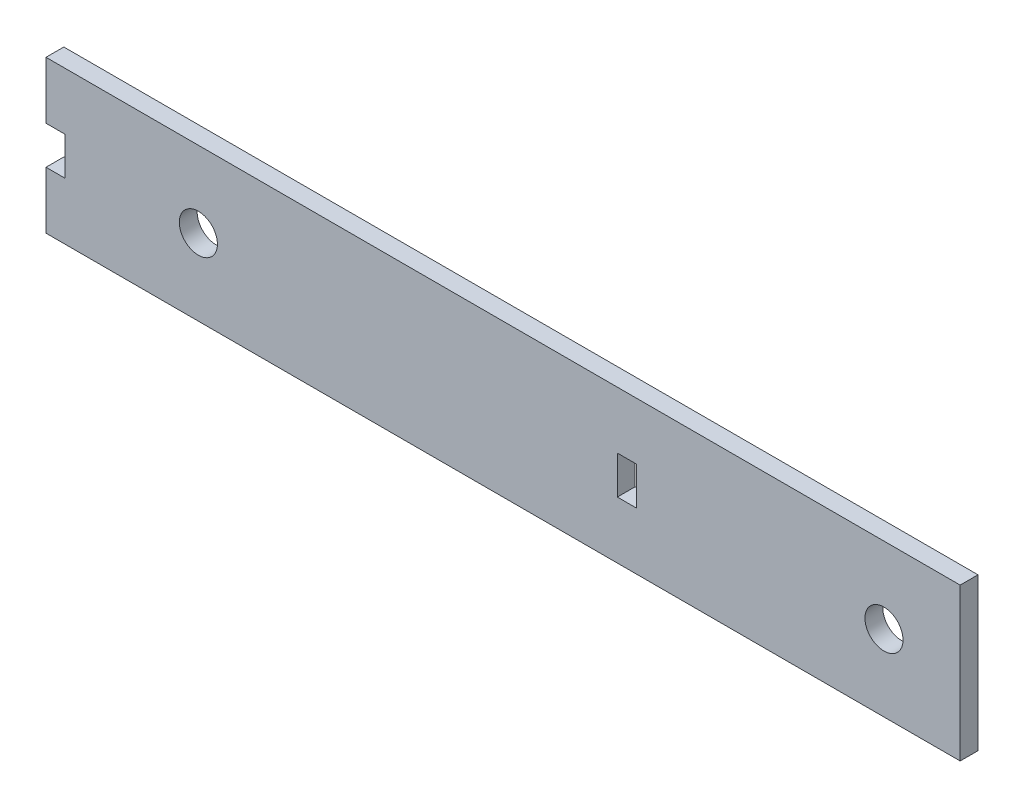
from build123d import *

# Parameters (mm, degrees)
SKETCH1_W           = 25.4
SKETCH1_H           = 152.4
BOSS_EXTRUDE1_DEPTH = 2.9718
SKETCH7_R           = 3.175
SKETCH7_W           = 6.35
SKETCH7_H           = 6.35
SKETCH7_W_2         = 3.175
CUT_EXTRUDE5_DEPTH  = 78.308224629


with BuildPart() as part:
    # Sketch1 → Boss-Extrude1 (new body)
    with BuildSketch(Plane(origin=(0, 0, 0), x_dir=(0, 1, 0), z_dir=(0, 0, 1))):
        Rectangle(SKETCH1_W, SKETCH1_H)
    extrude(amount=BOSS_EXTRUDE1_DEPTH)

    # Sketch7 → Cut-Extrude5 (cut, through all)
    with BuildSketch(Plane.XY.offset(2.9718)):
        with Locations((-50.8, 0)):
            Circle(SKETCH7_R)
        with Locations((63.5, 0)):
            Circle(SKETCH7_R)
        with Locations((-76.2, 0)):
            Rectangle(SKETCH7_W, SKETCH7_H)
        with Locations((20.6375, 0.008508047)):
            Rectangle(SKETCH7_W_2, SKETCH7_H)
    extrude(amount=-CUT_EXTRUDE5_DEPTH, mode=Mode.SUBTRACT)


solid = part.part
